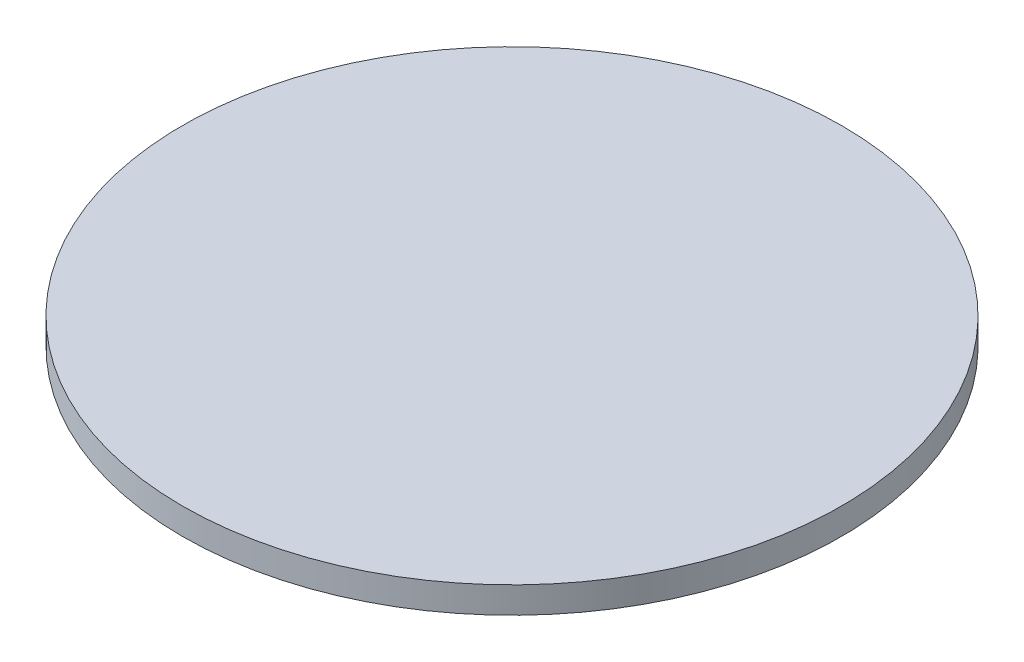
from build123d import *

# Parameters (mm, degrees)
SKETCH1_R           = 37.5
BOSS_EXTRUDE1_DEPTH = 3


with BuildPart() as part:
    # Sketch1 → Boss-Extrude1 (new body)
    with BuildSketch(Plane(origin=(0, 0, 0), x_dir=(1, 0, 0), z_dir=(0, 1, 0))):
        with Locations(Location((0, 0, 0), (0, 0, 270))):
            Circle(SKETCH1_R)
    extrude(amount=BOSS_EXTRUDE1_DEPTH)


solid = part.part
